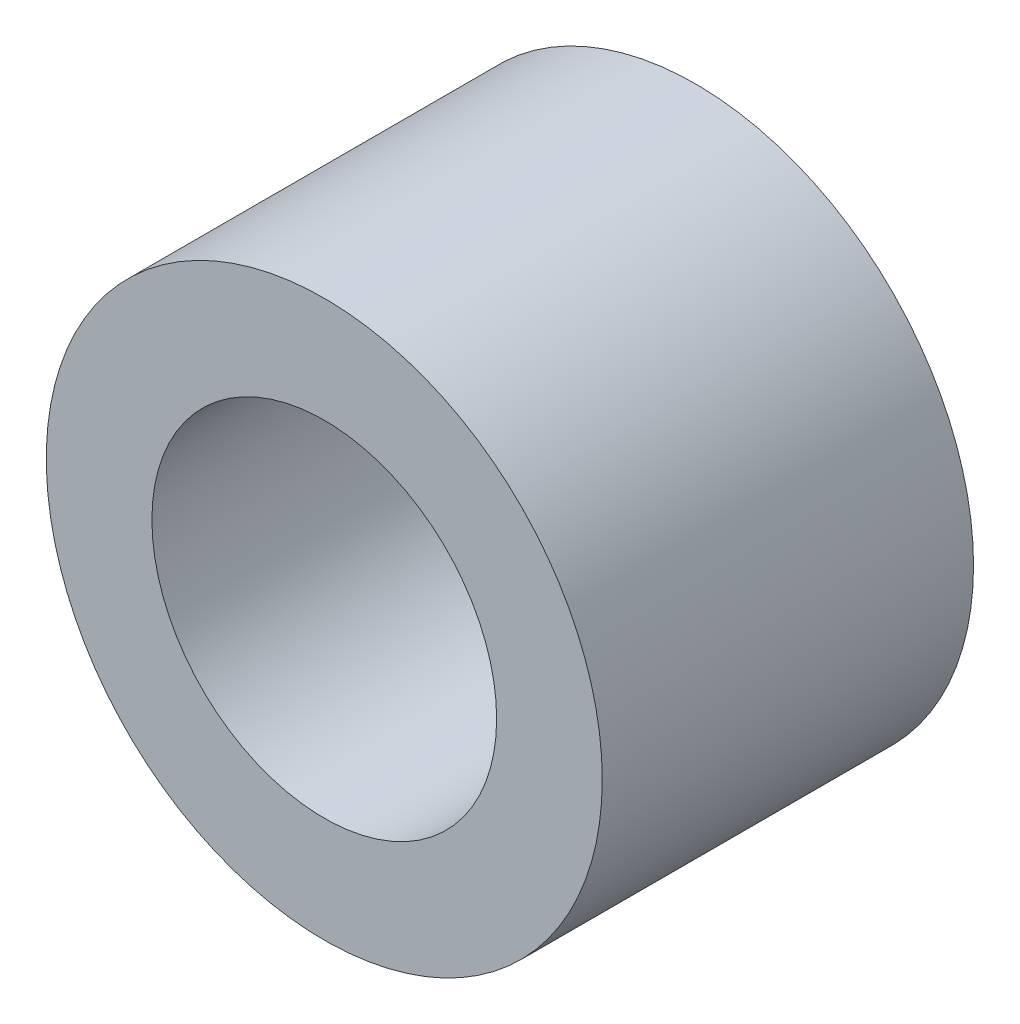
from build123d import *

# Parameters (mm, degrees)
SKETCH1_R           = 20.158634308
SKETCH1_R_2         = 12.500000019
BOSS_EXTRUDE1_DEPTH = 26.924


with BuildPart() as part:
    # Sketch1 → Boss-Extrude1 (new body)
    with BuildSketch(Plane.XY):
        Circle(SKETCH1_R)
        Circle(SKETCH1_R_2, mode=Mode.SUBTRACT)
    extrude(amount=BOSS_EXTRUDE1_DEPTH)


solid = part.part
